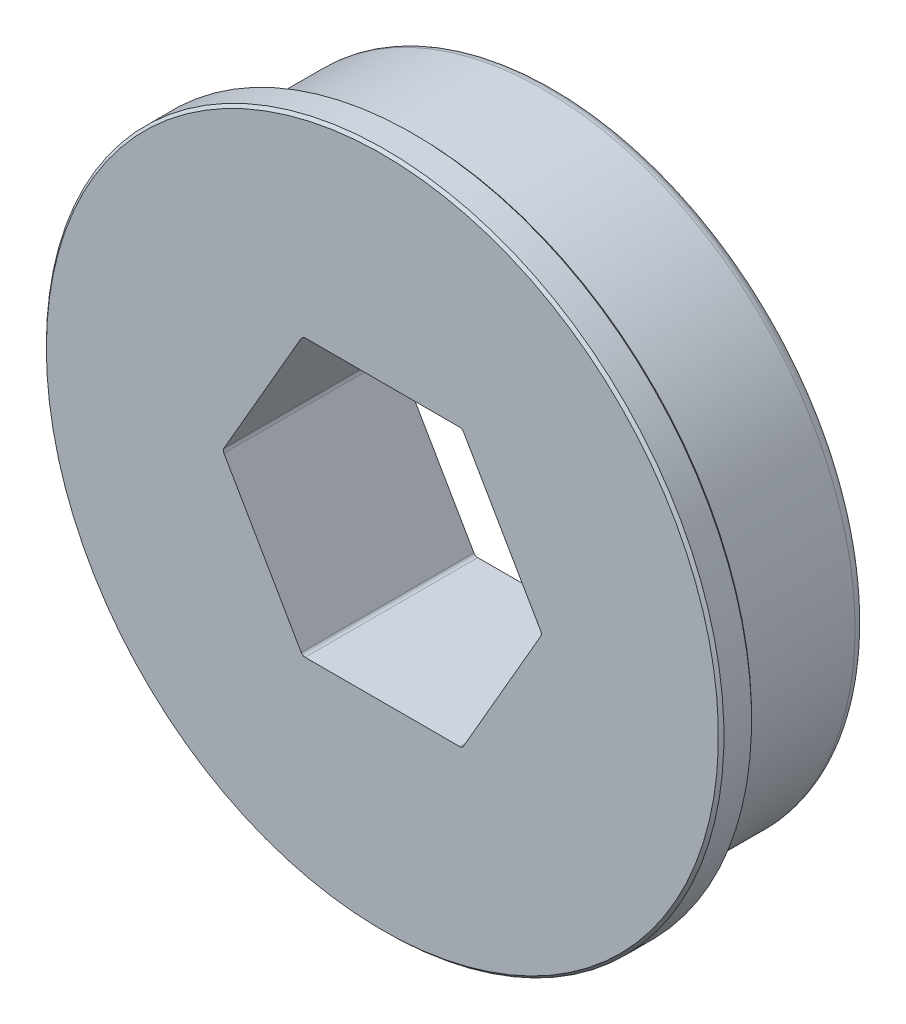
from build123d import *

# Parameters (mm, degrees)
CUT_EXTRUDE1_DEPTH = 24.386199605
CHAMFER1_SIZE      = 0.127
FILLET1_R          = 0.2032
FILLET2_R          = 0.508


with BuildPart() as part:
    # Sketch1 → Revolve1 (revolve)
    with BuildSketch(Plane.XZ, mode=Mode.PRIVATE) as revolve1_sk:
        Polygon((15.4305, 7.92734), (0, 7.92734), (0, 0), (14.2875, 0), (14.2875, 5.89534), (13.97, 5.89534), (13.97, 6.40334), (15.5575, 6.40334), (15.5575, 7.80034), align=None)
    revolve(revolve1_sk.sketch.rotate(Axis((0, 0, 7.92734), (0, 0, -1)), 180), axis=Axis((0, 0, 7.92734), (0, 0, -1)))

    # Sketch2 → Cut-Extrude1 (cut, through all)
    with BuildSketch(Plane.XY.offset(7.92734)):
        Polygon((3.666174209, -6.35), (7.332348419, 0), (3.666174209, 6.35), (-3.666174209, 6.35), (-7.332348419, 0), (-3.666174209, -6.35), align=None)
    extrude(amount=-CUT_EXTRUDE1_DEPTH, mode=Mode.SUBTRACT)

    # Chamfer1
    chamfer1_edges = [part.edges().sort_by_distance(p)[0] for p in [
        (15.5575, 0, 6.40334),
    ]]
    chamfer(chamfer1_edges, length=CHAMFER1_SIZE)

    # Fillet1
    fillet1_edges = [part.edges().sort_by_distance(p)[0] for p in [
        (3.666174209, -6.35, 3.96367),
        (-3.666174209, -6.35, 3.96367),
        (-7.332348419, 0, 3.96367),
        (-3.666174209, 6.35, 3.96367),
        (3.666174209, 6.35, 3.96367),
        (7.332348419, 0, 3.96367),
    ]]
    fillet(fillet1_edges, radius=FILLET1_R)

    # Fillet2
    fillet2_edges = [part.edges().sort_by_distance(p)[0] for p in [
        (14.2875, 0, 0),
    ]]
    fillet(fillet2_edges, radius=FILLET2_R)


solid = part.part
